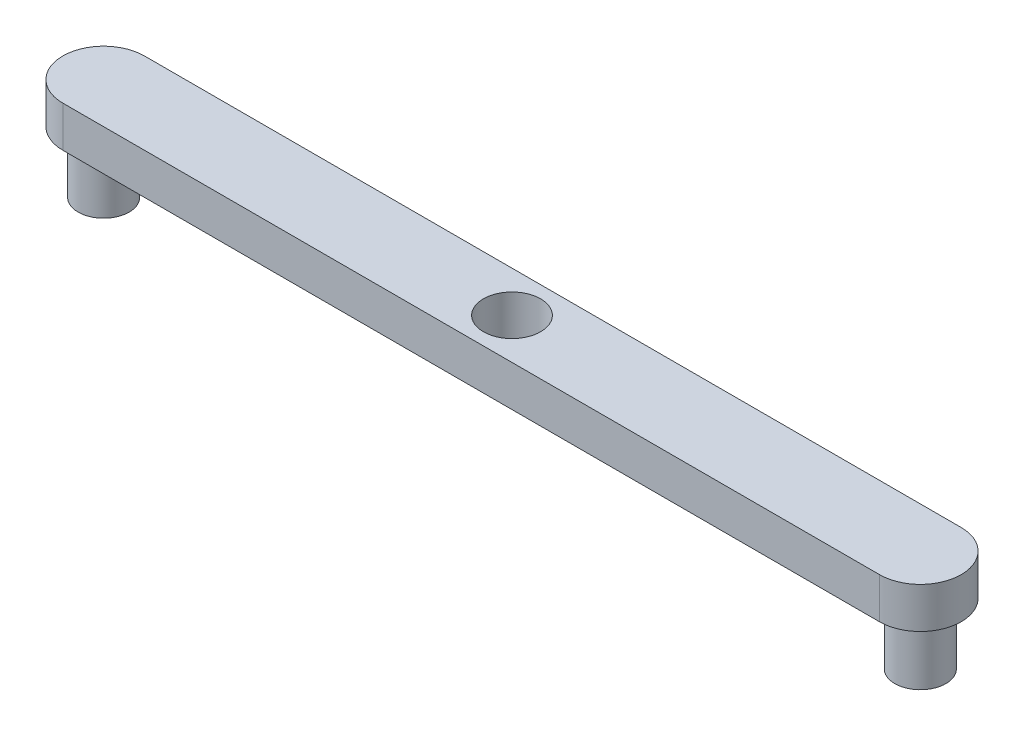
from build123d import *

# Parameters (mm, degrees)
BOSS_EXTRUDE1_DEPTH = 5.08
SKETCH3_R           = 3.175
BOSS_EXTRUDE2_DEPTH = 7.62
SKETCH7_R           = 3.556
CUT_EXTRUDE1_DEPTH  = 5.08


with BuildPart() as part:
    # Sketch2 → Boss-Extrude1 (new body)
    with BuildSketch(Plane(origin=(0, 0, 0), x_dir=(1, 0, 0), z_dir=(0, 1, 0))):
        with BuildLine():
            Line((-50.8, -5.08), (50.8, -5.08))
            ThreePointArc((50.8, -5.08), (55.88, 0), (50.8, 5.08))
            Line((50.8, 5.08), (-50.8, 5.08))
            ThreePointArc((-50.8, 5.08), (-55.88, 0), (-50.8, -5.08))
        make_face()
    extrude(amount=BOSS_EXTRUDE1_DEPTH)

    # Sketch3 → Boss-Extrude2 (add)
    with BuildSketch(Plane.XZ):
        with Locations(Location((-50.8, 0, 0), (0, 0, 90))):
            Circle(SKETCH3_R)
        with Locations(Location((50.8, 0, 0), (0, 0, 90))):
            Circle(SKETCH3_R)
    extrude(amount=BOSS_EXTRUDE2_DEPTH)

    # Sketch7 → Cut-Extrude1 (cut)
    with BuildSketch(Plane(origin=(0, 0, 0), x_dir=(1, 0, 0), z_dir=(0, 1, 0))):
        with Locations(Location((0, 0, 0), (0, 0, 270))):
            Circle(SKETCH7_R)
    extrude(amount=CUT_EXTRUDE1_DEPTH, mode=Mode.SUBTRACT)


solid = part.part
